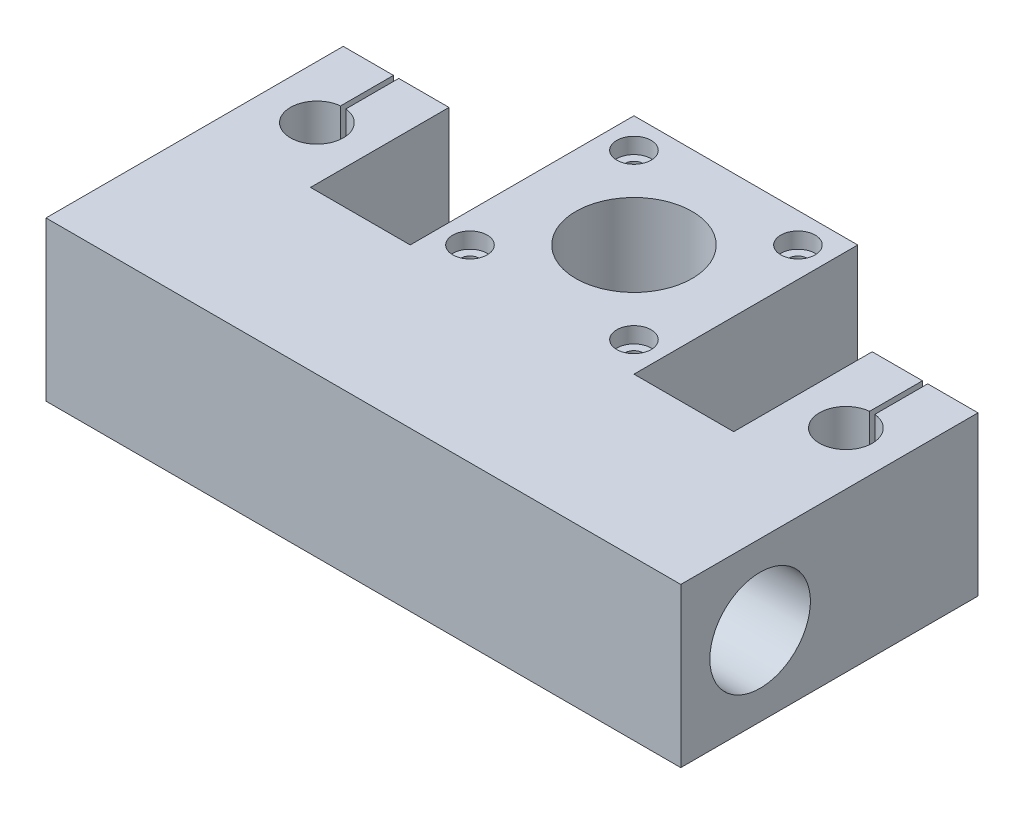
from build123d import *

# Parameters (mm, degrees)
SKETCH_3_R                  = 11
EXTRUDE_1_DEPTH             = 30
HOLE_WIZARD_M32_D           = 3.4
HOLE_WIZARD_M32_CBORE_D     = 6.5
HOLE_WIZARD_M32_CBORE_DEPTH = 3
SKETCH_15_R                 = 9.5
CUT_EXTRUDE_1_DEPTH         = 144.273479751


with BuildPart() as part:
    # Эскиз3 → Бобышка-Вытянуть1 (new body)
    with BuildSketch(Plane(origin=(0, 0, 0), x_dir=(1, 0, 0), z_dir=(0, 1, 0))):
        with BuildLine():
            Line((0, 0), (-60, 0))
            Line((-60, 0), (-60, 56.188060056))
            Line((-60, 56.188060056), (-50.5, 56.188060056))
            Line((-50.5, 56.188060056), (-50.5, 46.188060056))
            ThreePointArc((-50.5, 46.188060056), (-50, 36.21312287), (-49.5, 46.188060056))
            Line((-49.5, 46.188060056), (-49.5, 56.188060056))
            Line((-49.5, 56.188060056), (-40, 56.188060056))
            Line((-40, 56.188060056), (-40, 30))
            Line((-40, 30), (-21.15, 30))
            Line((-21.15, 30), (-21.15, 72.3))
            Line((-21.15, 72.3), (21.15, 72.3))
            Line((21.15, 72.3), (21.15, 30))
            Line((21.15, 30), (40, 30))
            Line((40, 30), (40, 56.188060056))
            Line((40, 56.188060056), (49.5, 56.188060056))
            Line((49.5, 56.188060056), (49.5, 46.188060056))
            ThreePointArc((49.5, 46.188060056), (50, 36.21312287), (50.5, 46.188060056))
            Line((50.5, 46.188060056), (50.5, 56.188060056))
            Line((50.5, 56.188060056), (60, 56.188060056))
            Line((60, 56.188060056), (60, 0))
            Line((60, 0), (0, 0))
        make_face()
        with Locations(Location((0, 51.15, 0), (0, 0, 270))):
            Circle(SKETCH_3_R, mode=Mode.SUBTRACT)
    extrude(amount=EXTRUDE_1_DEPTH)

    # Цековка для винта с внутренним шестигранником M32 (through all)
    with Locations(Plane(origin=(0, 30, 0), x_dir=(1, 0, 0), z_dir=(0, 1, 0))):
        with Locations((-15.5, 66.65), (15.5, 66.65), (15.5, 35.65), (-15.5, 35.65)):
            CounterBoreHole(HOLE_WIZARD_M32_D / 2, HOLE_WIZARD_M32_CBORE_D / 2, HOLE_WIZARD_M32_CBORE_DEPTH)

    # Эскиз15 → Вырез-Вытянуть1 (cut, through all)
    with BuildSketch(Plane.ZY.offset(60)):
        with Locations((-15, 15)):
            Circle(SKETCH_15_R)
    extrude(amount=-CUT_EXTRUDE_1_DEPTH, mode=Mode.SUBTRACT)


solid = part.part
